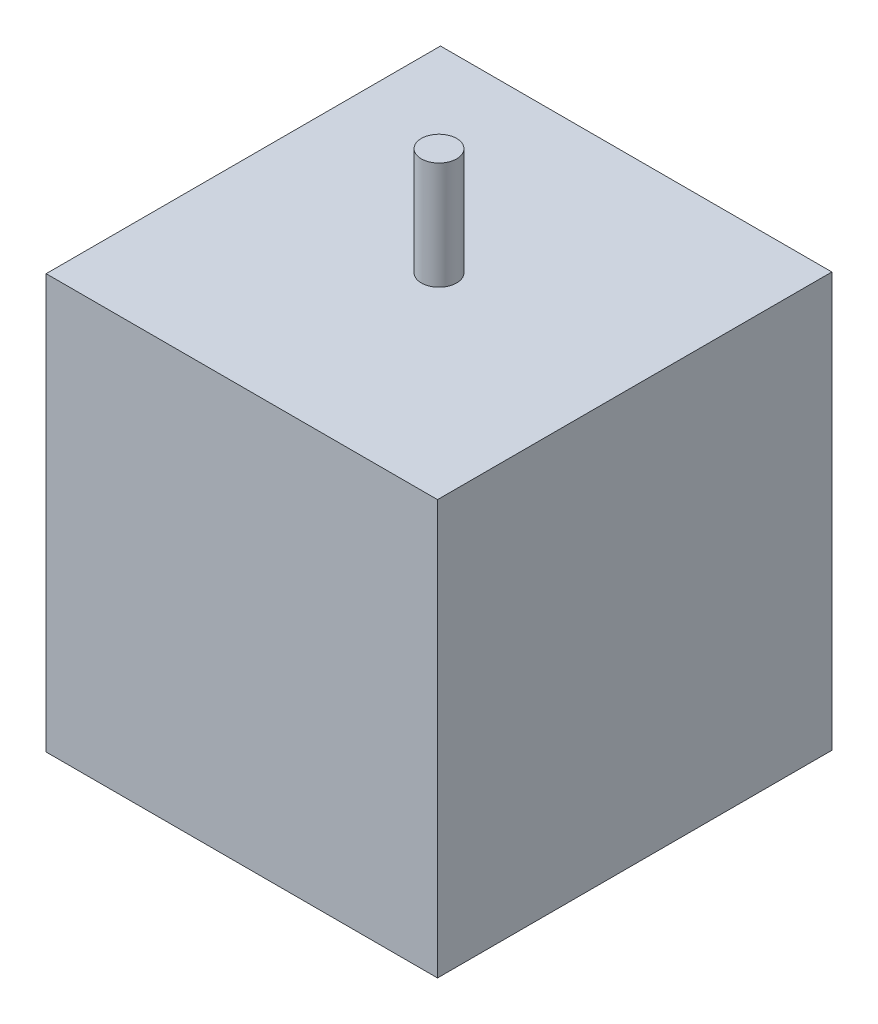
from build123d import *

# Parameters (mm, degrees)
SKETCH_1_W           = 109.173065233
SKETCH_1_H           = 115.560150299
EXTRUDE_1_DEPTH      = 110
EXTRUDE_2_DEPTH      = 30
EXTRUDE_2_DEPTH_BACK = 140
SKETCH_2_R           = 4.92730672


with BuildPart() as part:
    # 草图1 → 凸台-拉伸1 (new body)
    with BuildSketch(Plane.XY):
        with Locations((104.436974975, 57.78007515)):
            Rectangle(SKETCH_1_W, SKETCH_1_H)
    extrude(amount=EXTRUDE_1_DEPTH)

    # 草图2 → 凸台-拉伸2 (add, two sides: drawn at the far end of the back side and taken through both)
    with BuildSketch(Plane(origin=(0, 115.560150299, 0), x_dir=(1, 0, 0), z_dir=(0, 1, 0)).offset(-EXTRUDE_2_DEPTH_BACK)):
        with Locations(Location((104.436974975, -55, 0), (0, 0, 90))):
            Circle(SKETCH_2_R)
    extrude(amount=EXTRUDE_2_DEPTH + EXTRUDE_2_DEPTH_BACK)


solid = part.part
